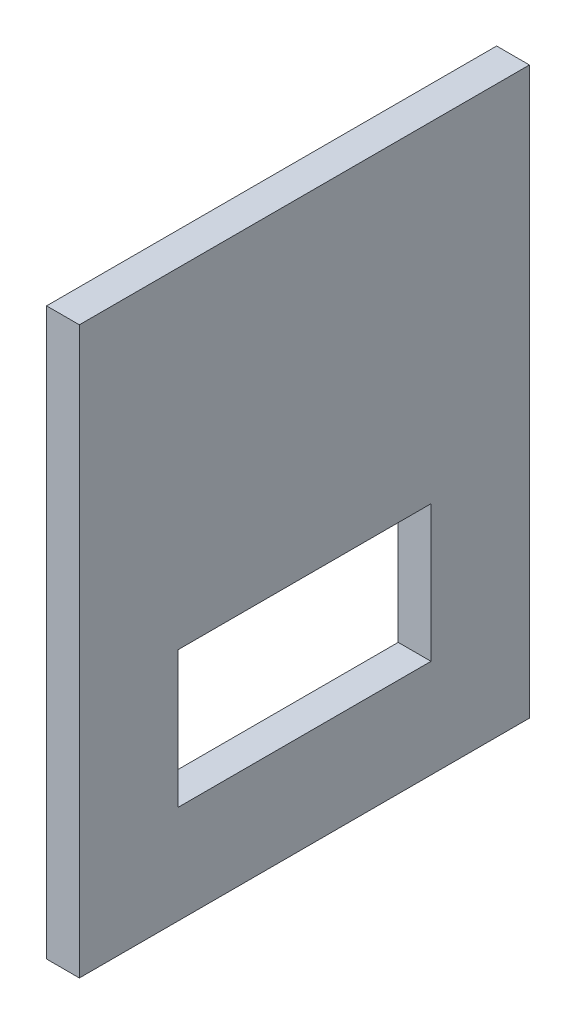
from build123d import *

# Parameters (mm, degrees)
SKETCH1_W           = 5
SKETCH1_H           = 86.2
BOSS_EXTRUDE1_DEPTH = 68.58
SKETCH3_W           = 38.58
SKETCH3_H           = 20.8
CUT_EXTRUDE2_DEPTH  = 5


with BuildPart() as part:
    # Sketch1 → Boss-Extrude1 (new body)
    with BuildSketch(Plane.XY):
        with Locations((2.5, 43.1)):
            Rectangle(SKETCH1_W, SKETCH1_H)
    extrude(amount=BOSS_EXTRUDE1_DEPTH)

    # Sketch3 → Cut-Extrude2 (cut)
    with BuildSketch(Plane.ZY):
        with Locations((34.29, 25.4)):
            Rectangle(SKETCH3_W, SKETCH3_H)
    extrude(amount=-CUT_EXTRUDE2_DEPTH, mode=Mode.SUBTRACT)


solid = part.part
